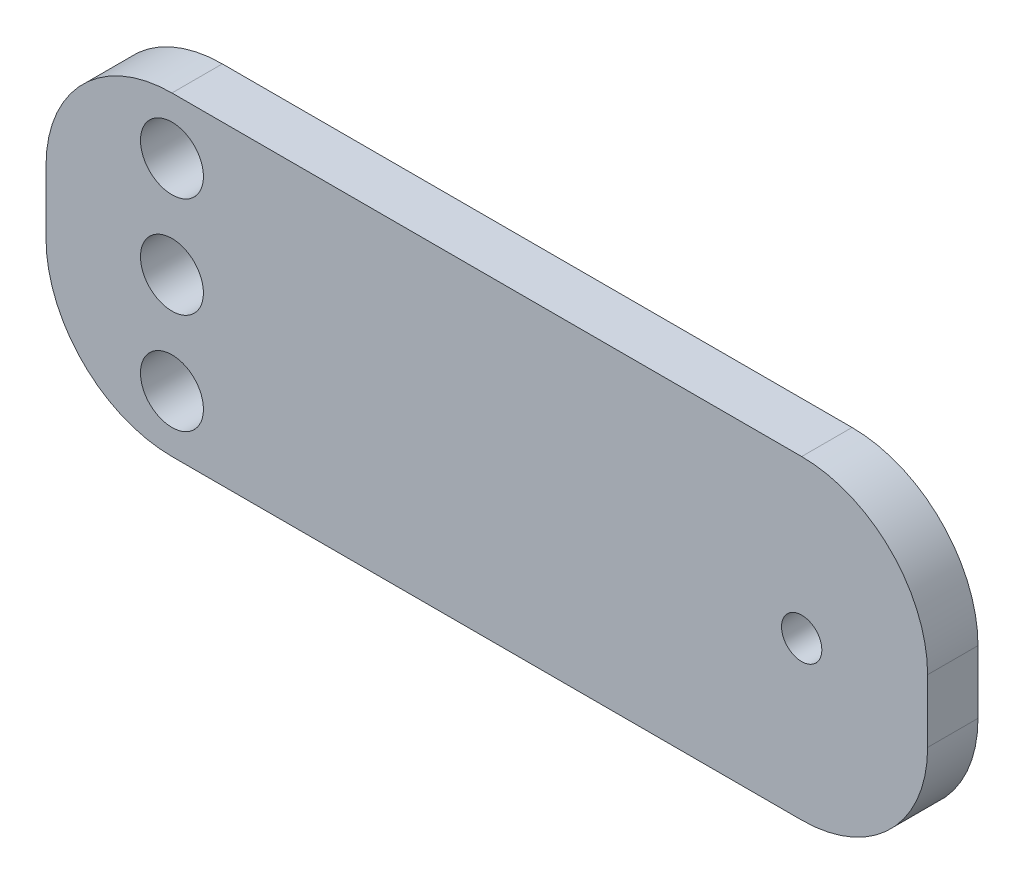
from build123d import *

# Parameters (mm, degrees)
SKETCH_1_W      = 70
SKETCH_1_H      = 25
SKETCH_1_R      = 2.5
SKETCH_1_R_2    = 1.6
EXTRUDE_1_DEPTH = 4
FILLET_1_R      = 10


with BuildPart() as part:
    # 草图1 → 凸台-拉伸1 (new body)
    with BuildSketch(Plane.XY):
        Rectangle(SKETCH_1_W, SKETCH_1_H)
        with Locations((-25, 0)):
            Circle(SKETCH_1_R, mode=Mode.SUBTRACT)
        with Locations((25, 0)):
            Circle(SKETCH_1_R_2, mode=Mode.SUBTRACT)
        with Locations((-25, 8)):
            Circle(SKETCH_1_R, mode=Mode.SUBTRACT)
        with Locations((-25, -8)):
            Circle(SKETCH_1_R, mode=Mode.SUBTRACT)
    extrude(amount=EXTRUDE_1_DEPTH)

    # 圆角1
    fillet_1_edges = [part.edges().sort_by_distance(p)[0] for p in [
        (35, -12.5, 2),
        (-35, -12.5, 2),
        (-35, 12.5, 2),
        (35, 12.5, 2),
    ]]
    fillet(fillet_1_edges, radius=FILLET_1_R)


solid = part.part
